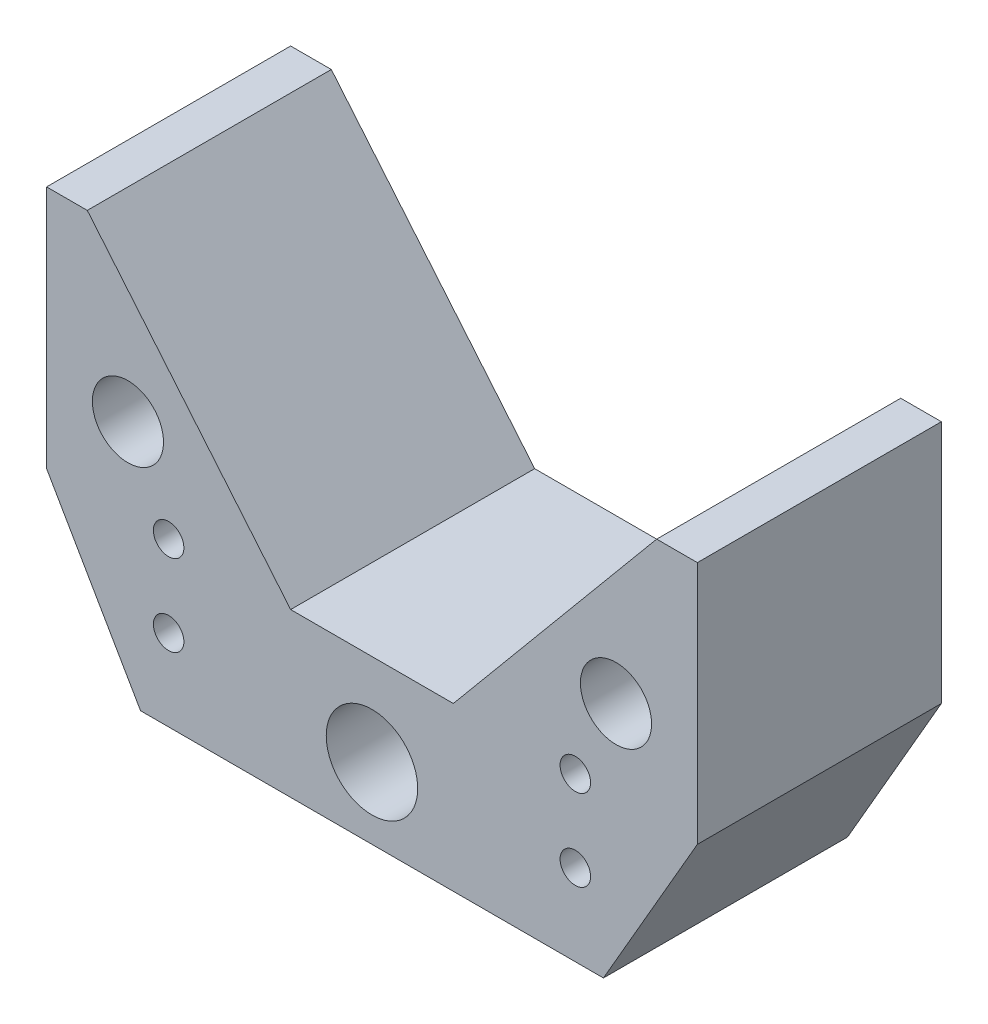
from build123d import *

# Parameters (mm, degrees)
SKETCH2_R           = 11.1125
SKETCH2_R_2         = 4.7625
SKETCH2_R_3         = 14.2875
BOSS_EXTRUDE1_DEPTH = 76.2


with BuildPart() as part:
    # Sketch2 → Boss-Extrude1 (new body)
    with BuildSketch(Plane.XY):
        Polygon((-72.609424084, 38.897905759), (-59.909424084, 38.897905759), (3.590575916, -37.302094241), (28.990575916, -37.302094241), (54.390575916, -37.302094241), (117.890575916, 38.897905759), (130.590575916, 38.897905759), (130.590575916, -37.302094241), (101.261182241, -88.102094241), (-43.280030409, -88.102094241), (-72.609424084, -37.302094241), align=None)
        with Locations(Location((-47.209424084, -11.902094241, 0), (0, 0, 180))):
            Circle(SKETCH2_R, mode=Mode.SUBTRACT)
        with Locations(Location((-34.509424084, -37.290472096, 0), (0, 0, 180))):
            Circle(SKETCH2_R_2, mode=Mode.SUBTRACT)
        with Locations(Location((-34.509424084, -62.690472096, 0), (0, 0, 180))):
            Circle(SKETCH2_R_2, mode=Mode.SUBTRACT)
        with Locations(Location((28.990575916, -65.877094241, 0), (0, 0, 180))):
            Circle(SKETCH2_R_3, mode=Mode.SUBTRACT)
        with Locations(Location((92.490575916, -37.290472096, 0), (0, 0, 180))):
            Circle(SKETCH2_R_2, mode=Mode.SUBTRACT)
        with Locations(Location((92.490575916, -62.690472096, 0), (0, 0, 180))):
            Circle(SKETCH2_R_2, mode=Mode.SUBTRACT)
        with Locations(Location((105.190575916, -11.902094241, 0), (0, 0, 180))):
            Circle(SKETCH2_R, mode=Mode.SUBTRACT)
    extrude(amount=BOSS_EXTRUDE1_DEPTH)


solid = part.part
